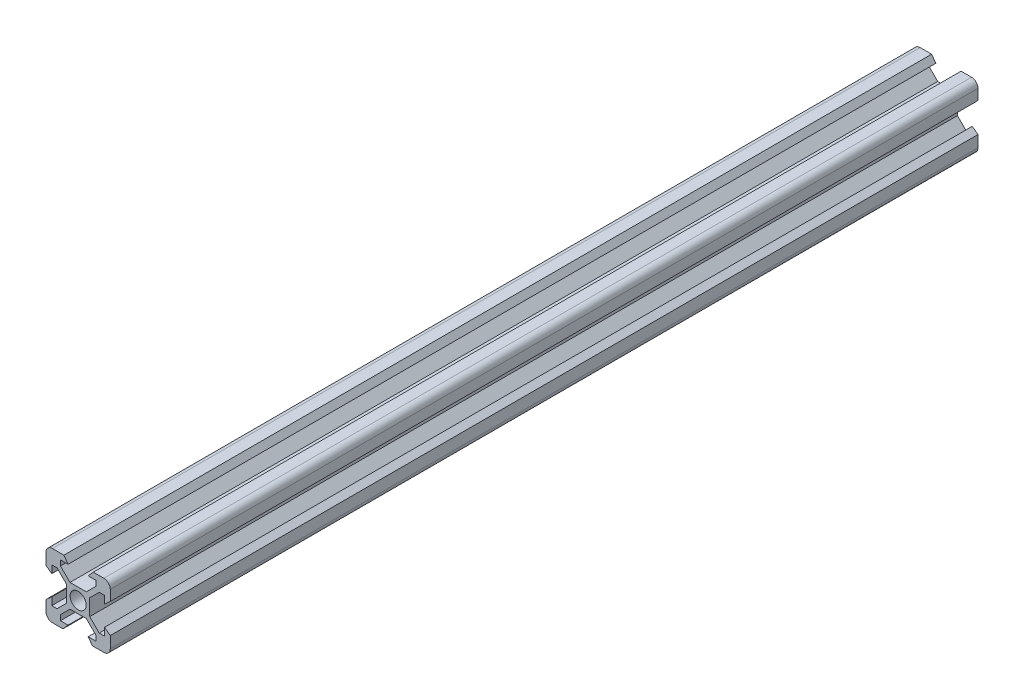
from build123d import *

# Parameters (mm, degrees)
SKETCH1_R           = 2.5
BOSS_EXTRUDE1_DEPTH = 270


with BuildPart() as part:
    # Sketch1 → Boss-Extrude1 (new body)
    with BuildSketch(Plane.XY):
        with BuildLine():
            Line((-4.725542729, -10), (-3.125, -8.2))
            Line((-3.125, -8.2), (-5.5, -8.2))
            Line((-5.5, -8.2), (-5.5, -6.560660172))
            Line((-5.5, -6.560660172), (-2.539339828, -3.6))
            Line((-2.539339828, -3.6), (2.539339828, -3.6))
            Line((2.539339828, -3.6), (5.5, -6.560660172))
            Line((5.5, -6.560660172), (5.5, -8.2))
            Line((5.5, -8.2), (3.125, -8.2))
            Line((3.125, -8.2), (4.434457271, -10))
            Line((4.434457271, -10), (8, -10))
            ThreePointArc((8, -10), (9.414213562, -9.414213562), (10, -8))
            Line((10, -8), (10, -4.434457271))
            Line((10, -4.434457271), (8.2, -3.125))
            Line((8.2, -3.125), (8.2, -5.5))
            Line((8.2, -5.5), (6.560660172, -5.5))
            Line((6.560660172, -5.5), (3.6, -2.539339828))
            Line((3.6, -2.539339828), (3.6, 2.539339828))
            Line((3.6, 2.539339828), (6.560660172, 5.5))
            Line((6.560660172, 5.5), (8.2, 5.5))
            Line((8.2, 5.5), (8.2, 3.125))
            Line((8.2, 3.125), (10, 4.725542729))
            Line((10, 4.725542729), (10, 8))
            ThreePointArc((10, 8), (9.414213562, 9.414213562), (8, 10))
            Line((8, 10), (4.725542729, 10))
            Line((4.725542729, 10), (3.125, 8.2))
            Line((3.125, 8.2), (5.5, 8.2))
            Line((5.5, 8.2), (5.5, 6.560660172))
            Line((5.5, 6.560660172), (2.539339828, 3.6))
            Line((2.539339828, 3.6), (-2.539339828, 3.6))
            Line((-2.539339828, 3.6), (-5.5, 6.560660172))
            Line((-5.5, 6.560660172), (-5.5, 8.2))
            Line((-5.5, 8.2), (-3.125, 8.2))
            Line((-3.125, 8.2), (-4.434457271, 10))
            Line((-4.434457271, 10), (-8, 10))
            ThreePointArc((-8, 10), (-9.414213562, 9.414213562), (-10, 8))
            Line((-10, 8), (-10, 4.434457271))
            Line((-10, 4.434457271), (-8.2, 3.125))
            Line((-8.2, 3.125), (-8.2, 5.5))
            Line((-8.2, 5.5), (-6.560660172, 5.5))
            Line((-6.560660172, 5.5), (-3.6, 2.539339828))
            Line((-3.6, 2.539339828), (-3.6, -2.539339828))
            Line((-3.6, -2.539339828), (-6.560660172, -5.5))
            Line((-6.560660172, -5.5), (-8.2, -5.5))
            Line((-8.2, -5.5), (-8.2, -3.125))
            Line((-8.2, -3.125), (-10, -4.725542729))
            Line((-10, -4.725542729), (-10, -8))
            ThreePointArc((-10, -8), (-9.414213562, -9.414213562), (-8, -10))
            Line((-8, -10), (-4.725542729, -10))
        make_face()
        Circle(SKETCH1_R, mode=Mode.SUBTRACT)
    extrude(amount=BOSS_EXTRUDE1_DEPTH)


solid = part.part
